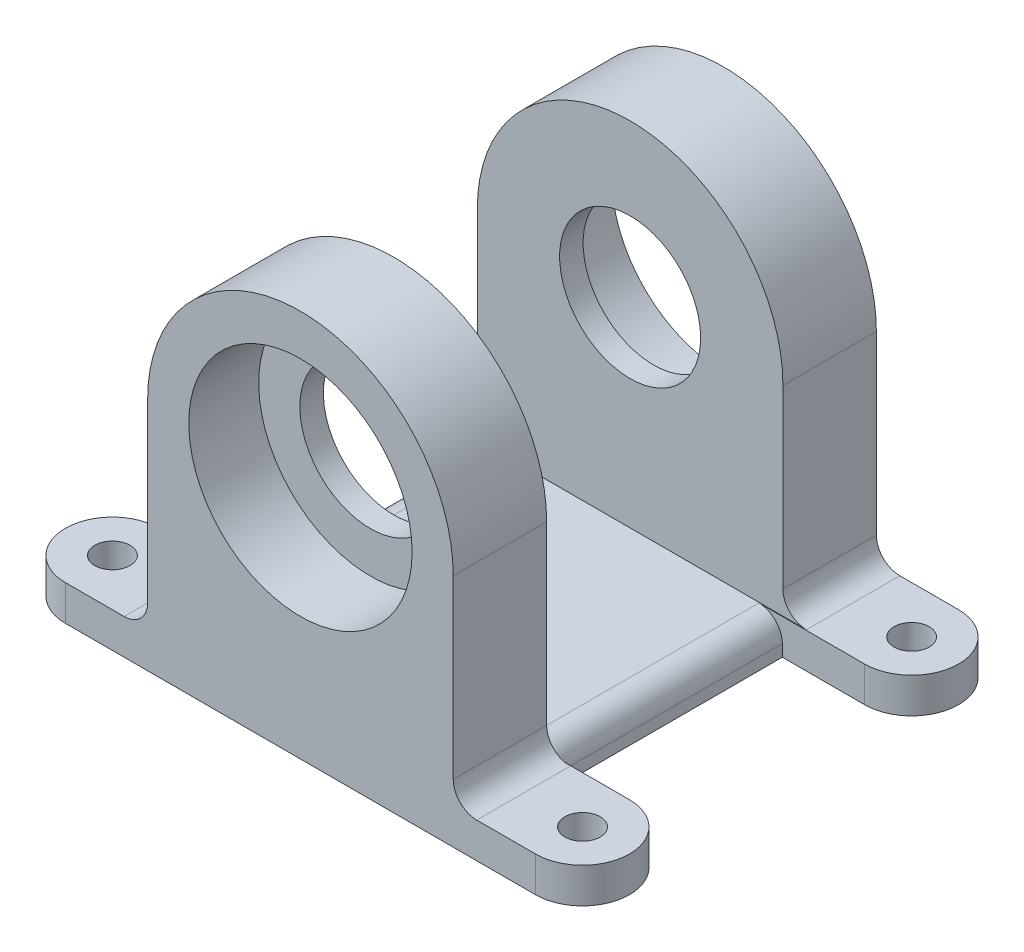
from build123d import *

# Parameters (mm, degrees)
CROQUIS1_R              = 9.5
SALIENTE_EXTRUIR1_DEPTH = 36
CROQUIS2_W              = 20.1
CROQUIS2_H              = 30
CORTAR_EXTRUIR2_DEPTH   = 49.703182648
CROQUIS3_R              = 9.5
CROQUIS3_R_2            = 6
SALIENTE_EXTRUIR2_DEPTH = 2
SALIENTE_EXTRUIR3_START = -2
CROQUIS4_R              = 9.5
CROQUIS4_R_2            = 6
SALIENTE_EXTRUIR3_DEPTH = 2
SALIENTE_EXTRUIR4_DEPTH = 3
CROQUIS6_R              = 1.5
CORTAR_EXTRUIR3_DEPTH   = 55.415071442
REDONDEO3_R             = 2


with BuildPart() as part:
    # Croquis1 → Saliente-Extruir1 (new body)
    with BuildSketch(Plane.XY):
        with BuildLine():
            Line((-13, 0), (-13, -20))
            Line((-13, -20), (13, -20))
            Line((13, -20), (13, 0))
            ThreePointArc((13, 0), (0, 13), (-13, 0))
        make_face()
        Circle(CROQUIS1_R, mode=Mode.SUBTRACT)
    extrude(amount=SALIENTE_EXTRUIR1_DEPTH)

    # Croquis2 → Cortar-Extruir2 (cut, through all)
    with BuildSketch(Plane(origin=(13, 0, 0), x_dir=(0, 0, -1), z_dir=(1, 0, 0))):
        with Locations((-18, -2)):
            Rectangle(CROQUIS2_W, CROQUIS2_H)
    extrude(amount=-CORTAR_EXTRUIR2_DEPTH, mode=Mode.SUBTRACT)

    # Croquis3 → Saliente-Extruir2 (add)
    with BuildSketch(Plane(origin=(0, 0, 28.05), x_dir=(-1, 0, 0), z_dir=(0, 0, -1))):
        with Locations(Location((0, 0, 0), (0, 0, 90))):
            Circle(CROQUIS3_R)
        with Locations(Location((0, 0, 0), (0, 0, 90))):
            Circle(CROQUIS3_R_2, mode=Mode.SUBTRACT)
    extrude(amount=-SALIENTE_EXTRUIR2_DEPTH)

    # Croquis4 → Saliente-Extruir3 (add)
    with BuildSketch(Plane.XY.offset(7.95).offset(SALIENTE_EXTRUIR3_START)):
        Circle(CROQUIS4_R)
        with Locations(Location((0, 0, 0), (0, 0, 90))):
            Circle(CROQUIS4_R_2, mode=Mode.SUBTRACT)
    extrude(amount=SALIENTE_EXTRUIR3_DEPTH)

    # Croquis5 → Saliente-Extruir4 (add)
    with BuildSketch(Plane.XZ.offset(20)):
        with BuildLine():
            Line((13, 36), (20, 36))
            ThreePointArc((20, 36), (24, 32), (20, 28))
            Line((20, 28), (13, 28))
            Line((13, 28), (13, 36))
        make_face()
        with BuildLine():
            Line((13, 0), (20, 0))
            ThreePointArc((20, 0), (24, 4), (20, 8))
            Line((20, 8), (13, 8))
            Line((13, 8), (13, 0))
        make_face()
        with BuildLine():
            Line((-13, 0), (-20, 0))
            ThreePointArc((-20, 0), (-24, 4), (-20, 8))
            Line((-20, 8), (-13, 8))
            Line((-13, 8), (-13, 0))
        make_face()
        with BuildLine():
            Line((-13, 28), (-13, 36))
            Line((-13, 36), (-20, 36))
            ThreePointArc((-20, 36), (-24, 32), (-20, 28))
            Line((-20, 28), (-13, 28))
        make_face()
    extrude(amount=-SALIENTE_EXTRUIR4_DEPTH)

    # Croquis6 → Cortar-Extruir3 (cut, through all)
    with BuildSketch(Plane.XZ.offset(20)):
        with Locations(Location((-20, 32, 0), (0, 0, 270))):
            Circle(CROQUIS6_R)
        with Locations(Location((20, 32, 0), (0, 0, 270))):
            Circle(CROQUIS6_R)
        with Locations(Location((-20, 4, 0), (0, 0, 270))):
            Circle(CROQUIS6_R)
        with Locations(Location((20, 4, 0), (0, 0, 270))):
            Circle(CROQUIS6_R)
    extrude(amount=-CORTAR_EXTRUIR3_DEPTH, mode=Mode.SUBTRACT)

    # Redondeo3
    redondeo3_edges = [part.edges().sort_by_distance(p)[0] for p in [
        (13, -17, 18),
        (-13, -17, 18),
        (-13, -17, 32.025),
        (-13, -17, 3.975),
        (13, -17, 3.975),
        (13, -17, 32.025),
    ]]
    fillet(redondeo3_edges, radius=REDONDEO3_R)


solid = part.part
